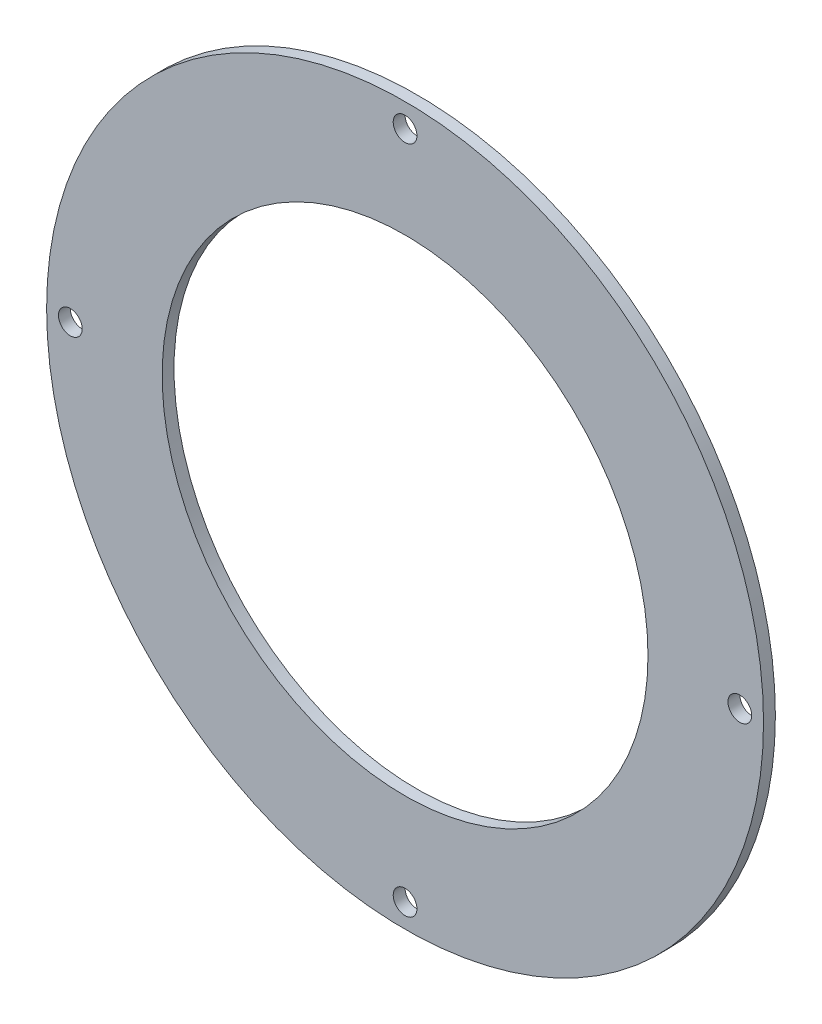
from build123d import *

# Parameters (mm, degrees)
SKETCH_1_R          = 60.5
SKETCH_1_R_2        = 2
SKETCH_1_R_3        = 2.6
SKETCH_1_R_4        = 15.5
EXTRUDE_1_DEPTH     = 2
SKETCH_2_R          = 41
CUT_EXTRUDE_1_DEPTH = 10


with BuildPart() as part:
    # 草图1 → 凸台-拉伸1 (new body)
    with BuildSketch(Plane.XY):
        Circle(SKETCH_1_R)
        with Locations((0, -56.5)):
            Circle(SKETCH_1_R_2, mode=Mode.SUBTRACT)
        with Locations((-56.5, 0)):
            Circle(SKETCH_1_R_2, mode=Mode.SUBTRACT)
        with Locations((0, 56.5)):
            Circle(SKETCH_1_R_2, mode=Mode.SUBTRACT)
        with Locations((56.5, 0)):
            Circle(SKETCH_1_R_2, mode=Mode.SUBTRACT)
        with Locations((0, -23.75)):
            Circle(SKETCH_1_R_3, mode=Mode.SUBTRACT)
        with Locations((-20.56810334, 11.875)):
            Circle(SKETCH_1_R_3, mode=Mode.SUBTRACT)
        with Locations((20.56810334, 11.875)):
            Circle(SKETCH_1_R_3, mode=Mode.SUBTRACT)
        with Locations((19.485571585, -11.25)):
            Circle(SKETCH_1_R_3, mode=Mode.SUBTRACT)
        with Locations((-19.485571585, -11.25)):
            Circle(SKETCH_1_R_3, mode=Mode.SUBTRACT)
        with Locations((0, 22.5)):
            Circle(SKETCH_1_R_3, mode=Mode.SUBTRACT)
        Circle(SKETCH_1_R_4, mode=Mode.SUBTRACT)
    extrude(amount=EXTRUDE_1_DEPTH)

    # 草图2 → 切除-拉伸1 (cut)
    with BuildSketch(Plane.XY.offset(2)):
        Circle(SKETCH_2_R)
    extrude(amount=-CUT_EXTRUDE_1_DEPTH, mode=Mode.SUBTRACT)


solid = part.part
